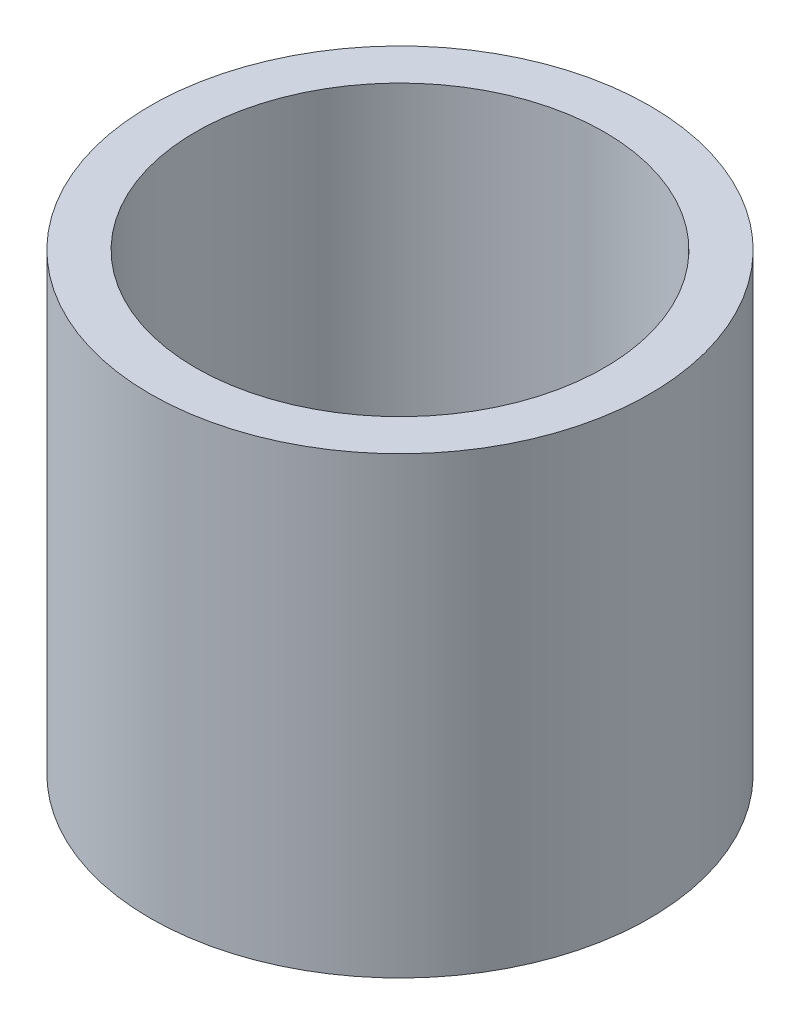
from build123d import *

# Parameters (mm, degrees)
SKETCH1_R           = 8.73125
SKETCH1_R_2         = 7.14375
BOSS_EXTRUDE1_DEPTH = 15.875


with BuildPart() as part:
    # Sketch1 → Boss-Extrude1 (new body)
    with BuildSketch(Plane(origin=(0, 0, 0), x_dir=(1, 0, 0), z_dir=(0, 1, 0))):
        with Locations(Location((0, 0, 0), (0, 0, 270))):
            Circle(SKETCH1_R)
        with Locations(Location((0, 0, 0), (0, 0, 270))):
            Circle(SKETCH1_R_2, mode=Mode.SUBTRACT)
    extrude(amount=BOSS_EXTRUDE1_DEPTH)


solid = part.part
